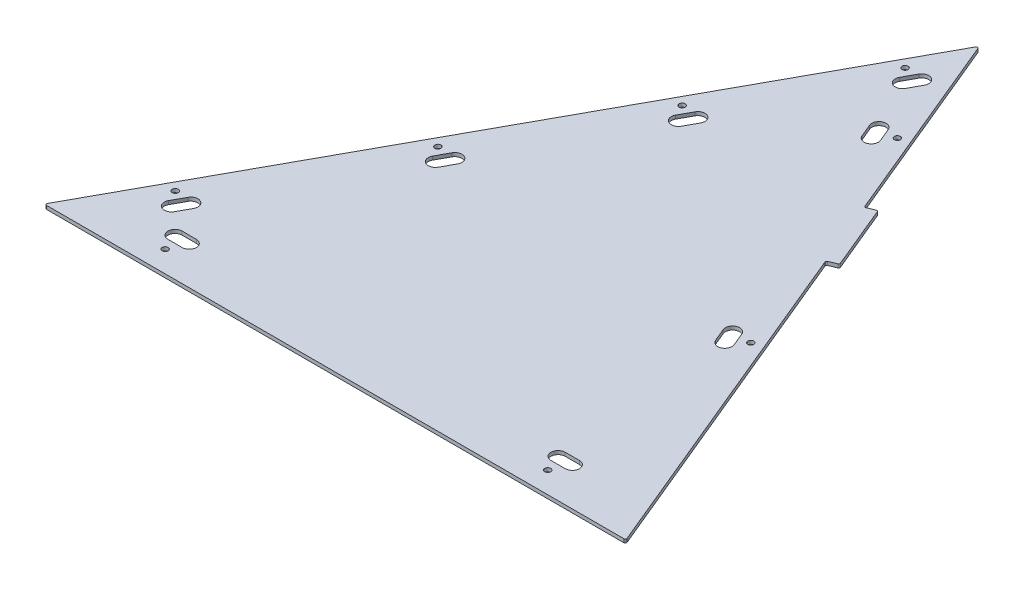
from build123d import *

# Parameters (mm, degrees)
SKETCH4_R           = 5.3578125
BOSS_EXTRUDE2_DEPTH = 6.35
CUT_EXTRUDE1_DEPTH  = 1277.826258948
FILLET1_R           = 2.54


with BuildPart() as part:
    # Sketch4 → Boss-Extrude2 (new body)
    # profile 1 of 2: a face of its own
    with BuildSketch(Plane(origin=(0, 0, 0), x_dir=(1, 0, 0), z_dir=(0, 1, 0))):
        Polygon((234.979236566, 1078.971634327), (-356.170330123, 0), (682.689669877, 0), (429.674039163, 609.761730508), (381.000338514, 727.064206463), align=None)
        with Locations(Location((-178.370330123, 38.1, 0), (0, 0, 270))):
            Circle(SKETCH4_R, mode=Mode.SUBTRACT)
        with Locations(Location((-259.300975608, 137.16, 0), (0, 0, 270))):
            Circle(SKETCH4_R, mode=Mode.SUBTRACT)
        with Locations(Location((-93.289784566, 440.165155055, 0), (0, 0, 270))):
            Circle(SKETCH4_R, mode=Mode.SUBTRACT)
        with Locations(Location((504.889669877, 38.1, 0), (0, 0, 270))):
            Circle(SKETCH4_R, mode=Mode.SUBTRACT)
        with Locations(Location((489.29326545, 416.375307605, 0), (0, 0, 270))):
            Circle(SKETCH4_R, mode=Mode.SUBTRACT)
        with Locations(Location((61.094542054, 721.948850069, 0), (0, 0, 270))):
            Circle(SKETCH4_R, mode=Mode.SUBTRACT)
        with Locations(Location((303.667495105, 863.729056592, 0), (0, 0, 270))):
            Circle(SKETCH4_R, mode=Mode.SUBTRACT)
        with Locations(Location((201.97392089, 979.083189991, 0), (0, 0, 270))):
            Circle(SKETCH4_R, mode=Mode.SUBTRACT)
    # profile 2 of 2: a face of its own
    with BuildSketch(Plane(origin=(0, 0, 0), x_dir=(1, 0, 0), z_dir=(0, 1, 0))):
        Polygon((429.674039163, 609.761730508), (381.000338514, 727.064206463), (398.595709907, 734.36526156), (447.269410556, 617.062785606), align=None)
    extrude(amount=BOSS_EXTRUDE2_DEPTH)

    # Sketch5 → Cut-Extrude1 (cut, through all)
    with BuildSketch(Plane(origin=(0, 6.35, 0), x_dir=(1, 0, 0), z_dir=(0, 1, 0))):
        with BuildLine():
            Line((-250.361653335, 116.472417753), (-238.157149202, 138.748191115))
            ThreePointArc((-238.157149202, 138.748191115), (-220.917010455, 143.783825729), (-215.88137584, 126.543686982))
            Line((-215.88137584, 126.543686982), (-228.085879973, 104.26791362))
            ThreePointArc((-228.085879973, 104.26791362), (-245.326018721, 99.232279006), (-250.361653335, 116.472417753))
        make_face()
        with BuildLine():
            Line((-191.070330123, 81.28), (-165.670330123, 81.28))
            ThreePointArc((-165.670330123, 81.28), (-152.970330123, 68.58), (-165.670330123, 55.88))
            Line((-165.670330123, 55.88), (-191.070330123, 55.88))
            ThreePointArc((-191.070330123, 55.88), (-203.770330123, 68.58), (-191.070330123, 81.28))
        make_face()
        with BuildLine():
            Line((-83.493702347, 421.041338954), (-71.289198214, 443.317112316))
            ThreePointArc((-71.289198214, 443.317112316), (-54.049059466, 448.35274693), (-49.013424852, 431.112608183))
            Line((-49.013424852, 431.112608183), (-61.217928985, 408.836834821))
            ThreePointArc((-61.217928985, 408.836834821), (-78.458067732, 403.801200206), (-83.493702347, 421.041338954))
        make_face()
        with BuildLine():
            Line((211.607161604, 959.662154075), (223.811665737, 981.937927436))
            ThreePointArc((223.811665737, 981.937927436), (241.051804485, 986.973562051), (246.087439099, 969.733423303))
            Line((246.087439099, 969.733423303), (233.882934966, 947.457649942))
            ThreePointArc((233.882934966, 947.457649942), (216.642796219, 942.422015327), (211.607161604, 959.662154075))
        make_face()
        with BuildLine():
            Line((70.0689996, 701.325397046), (82.328936684, 723.702347141))
            ThreePointArc((82.328936684, 723.702347141), (99.569075432, 728.737981755), (104.604710046, 711.497843008))
            Line((104.604710046, 711.497843008), (92.344772962, 689.120892913))
            ThreePointArc((92.344772962, 689.120892913), (75.104634214, 684.085258298), (70.0689996, 701.325397046))
        make_face()
        with BuildLine():
            Line((467.764558528, 421.867197937), (477.499298658, 398.406702746))
            ThreePointArc((477.499298658, 398.406702746), (470.636421128, 381.809085085), (454.038803467, 388.671962616))
            Line((454.038803467, 388.671962616), (444.304063337, 412.132457807))
            ThreePointArc((444.304063337, 412.132457807), (451.166940868, 428.730075467), (467.764558528, 421.867197937))
        make_face()
        with BuildLine():
            Line((492.961263737, 81.28), (518.361263737, 81.28))
            ThreePointArc((518.361263737, 81.28), (531.061263737, 68.58), (518.361263737, 55.88))
            Line((518.361263737, 55.88), (492.961263737, 55.88))
            ThreePointArc((492.961263737, 55.88), (480.261263737, 68.58), (492.961263737, 81.28))
        make_face()
        with BuildLine():
            Line((282.363160209, 868.680215609), (292.097900339, 845.219720419))
            ThreePointArc((292.097900339, 845.219720419), (285.235022808, 828.622102758), (268.637405148, 835.484980289))
            Line((268.637405148, 835.484980289), (258.902665018, 858.94547548))
            ThreePointArc((258.902665018, 858.94547548), (265.765542549, 875.54309314), (282.363160209, 868.680215609))
        make_face()
    extrude(amount=-CUT_EXTRUDE1_DEPTH, mode=Mode.SUBTRACT)

    # Fillet1
    fillet1_edges = [part.edges().sort_by_distance(p)[0] for p in [
        (682.689669877, 3.175, 0),
        (-356.170330123, 3.175, 0),
        (234.979236566, 3.175, -1078.971634327),
        (381.000338514, 3.175, -727.064206463),
        (429.674039163, 3.175, -609.761730508),
        (447.269410556, 3.175, -617.062785606),
        (398.595709907, 3.175, -734.36526156),
    ]]
    fillet(fillet1_edges, radius=FILLET1_R)


solid = part.part
